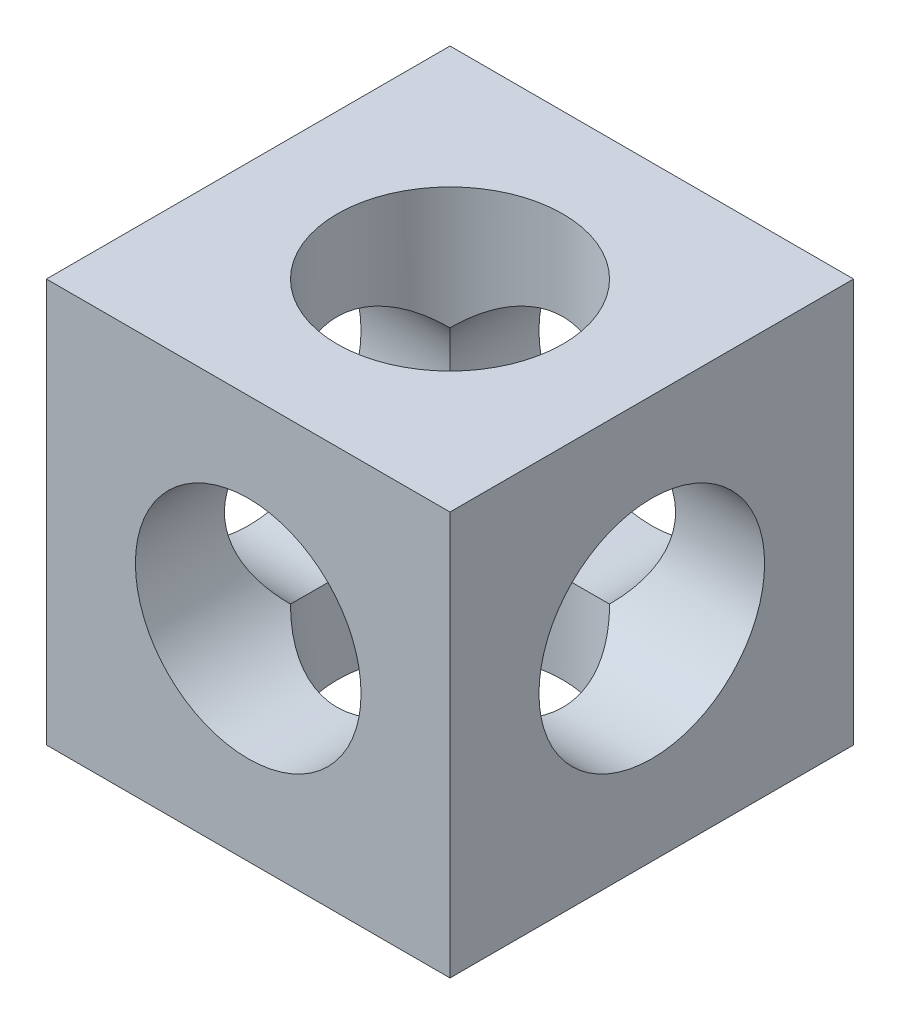
from build123d import *

# Parameters (mm, degrees)
SKETCH1_W           = 12.7
SKETCH1_H           = 12.7
BOSS_EXTRUDE1_DEPTH = 12.7
SKETCH2_R           = 3.55
CUT_EXTRUDE1_DEPTH  = 22.997045256
SKETCH3_R           = 3.55
CUT_EXTRUDE2_DEPTH  = 22.997045256
SKETCH4_R           = 3.55
CUT_EXTRUDE3_DEPTH  = 22.997045256


with BuildPart() as part:
    # Sketch1 → Boss-Extrude1 (new body)
    with BuildSketch(Plane(origin=(0, 0, 0), x_dir=(1, 0, 0), z_dir=(0, 1, 0))):
        with Locations((6.35, 6.35)):
            Rectangle(SKETCH1_W, SKETCH1_H)
    extrude(amount=BOSS_EXTRUDE1_DEPTH)

    # Sketch2 → Cut-Extrude1 (cut, through all)
    with BuildSketch(Plane(origin=(0, 12.7, 0), x_dir=(1, 0, 0), z_dir=(0, 1, 0))):
        with Locations(Location((6.35, 6.35, 0), (0, 0, 270))):
            Circle(SKETCH2_R)
    extrude(amount=-CUT_EXTRUDE1_DEPTH, mode=Mode.SUBTRACT)

    # Sketch3 → Cut-Extrude2 (cut, through all)
    with BuildSketch(Plane(origin=(12.7, 0, 0), x_dir=(0, 0, -1), z_dir=(1, 0, 0))):
        with Locations((6.35, 6.35)):
            Circle(SKETCH3_R)
    extrude(amount=-CUT_EXTRUDE2_DEPTH, mode=Mode.SUBTRACT)

    # Sketch4 → Cut-Extrude3 (cut, through all)
    with BuildSketch(Plane.XY):
        with Locations((6.35, 6.35)):
            Circle(SKETCH4_R)
    extrude(amount=-CUT_EXTRUDE3_DEPTH, mode=Mode.SUBTRACT)


solid = part.part
